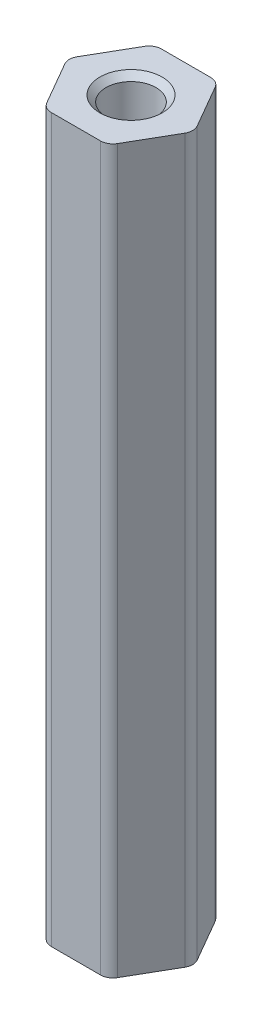
from build123d import *

# Parameters (mm, degrees)
BOSS_EXTRUDE1_DEPTH                = 29.591
FILLET1_R                          = 0.508
M2_5X0_45_TAPPED_HOLE1_D           = 2.05
M2_5X0_45_TAPPED_HOLE1_CSINK_D     = 2.55
M2_5X0_45_TAPPED_HOLE1_CSINK_ANGLE = 90


with BuildPart() as part:
    # Sketch1 → Boss-Extrude1 (new body)
    with BuildSketch(Plane(origin=(0, 0, 0), x_dir=(1, 0, 0), z_dir=(0, 1, 0))):
        Polygon((-2.6035, 0), (-1.30175, 2.254697139), (1.30175, 2.254697139), (2.6035, 0), (1.30175, -2.254697139), (-1.30175, -2.254697139), align=None)
    extrude(amount=BOSS_EXTRUDE1_DEPTH)

    # Fillet1
    fillet1_edges = [part.edges().sort_by_distance(p)[0] for p in [
        (-2.6035, 14.7955, 0),
        (-1.30175, 14.7955, 2.254697139),
        (1.30175, 14.7955, 2.254697139),
        (2.6035, 14.7955, 0),
        (1.30175, 14.7955, -2.254697139),
        (-1.30175, 14.7955, -2.254697139),
    ]]
    fillet(fillet1_edges, radius=FILLET1_R)

    # M2.5x0.45 Tapped Hole1 (through all)
    with Locations(Plane.ZX.offset(29.591)):
        with Locations((0, 0)):
            CounterSinkHole(M2_5X0_45_TAPPED_HOLE1_D / 2, M2_5X0_45_TAPPED_HOLE1_CSINK_D / 2, counter_sink_angle=M2_5X0_45_TAPPED_HOLE1_CSINK_ANGLE)


solid = part.part
